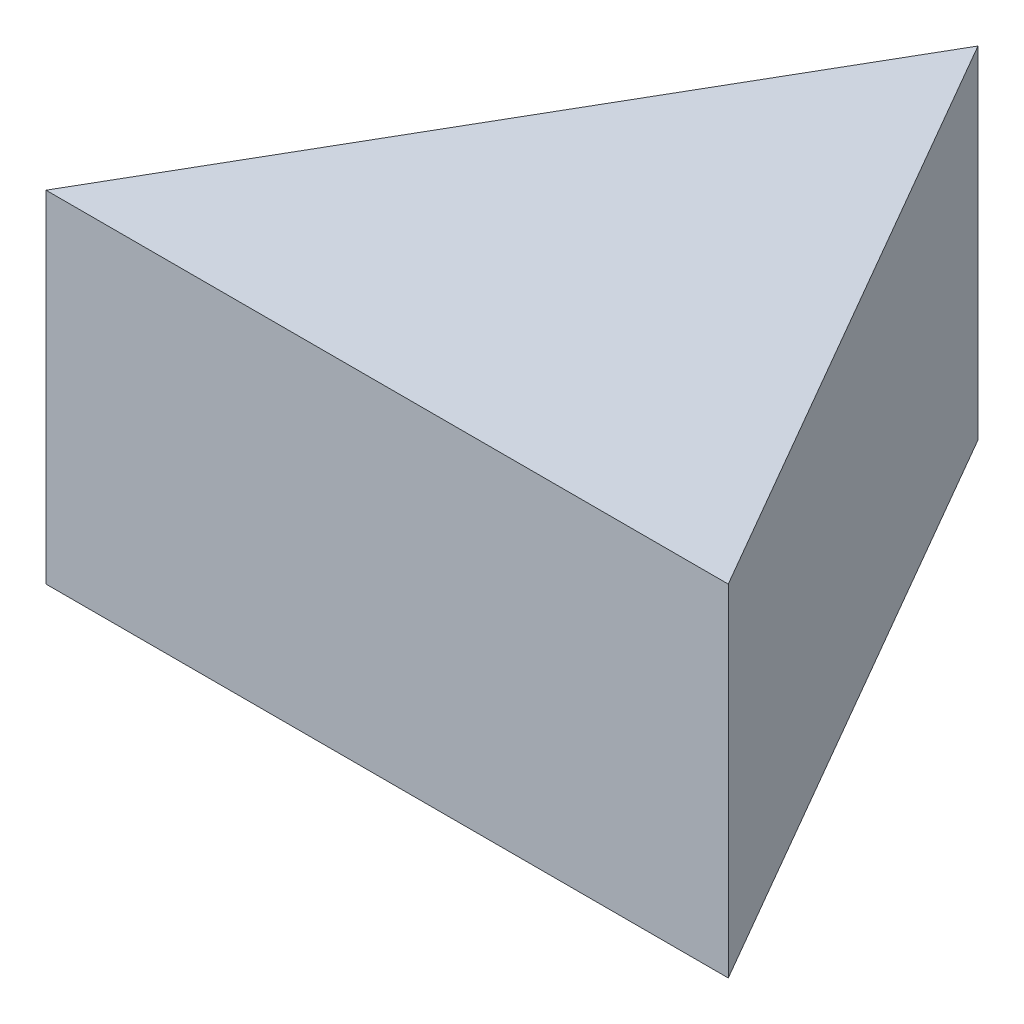
from build123d import *

# Parameters (mm, degrees)
BOSS_EXTRUDE1_DEPTH = 5


with BuildPart() as part:
    # Sketch1 → Boss-Extrude1 (new body)
    with BuildSketch(Plane(origin=(0, 0, 0), x_dir=(1, 0, 0), z_dir=(0, 1, 0))):
        Polygon((0, 0), (5, 8.660254038), (10, 0), align=None)
    extrude(amount=BOSS_EXTRUDE1_DEPTH)


solid = part.part
